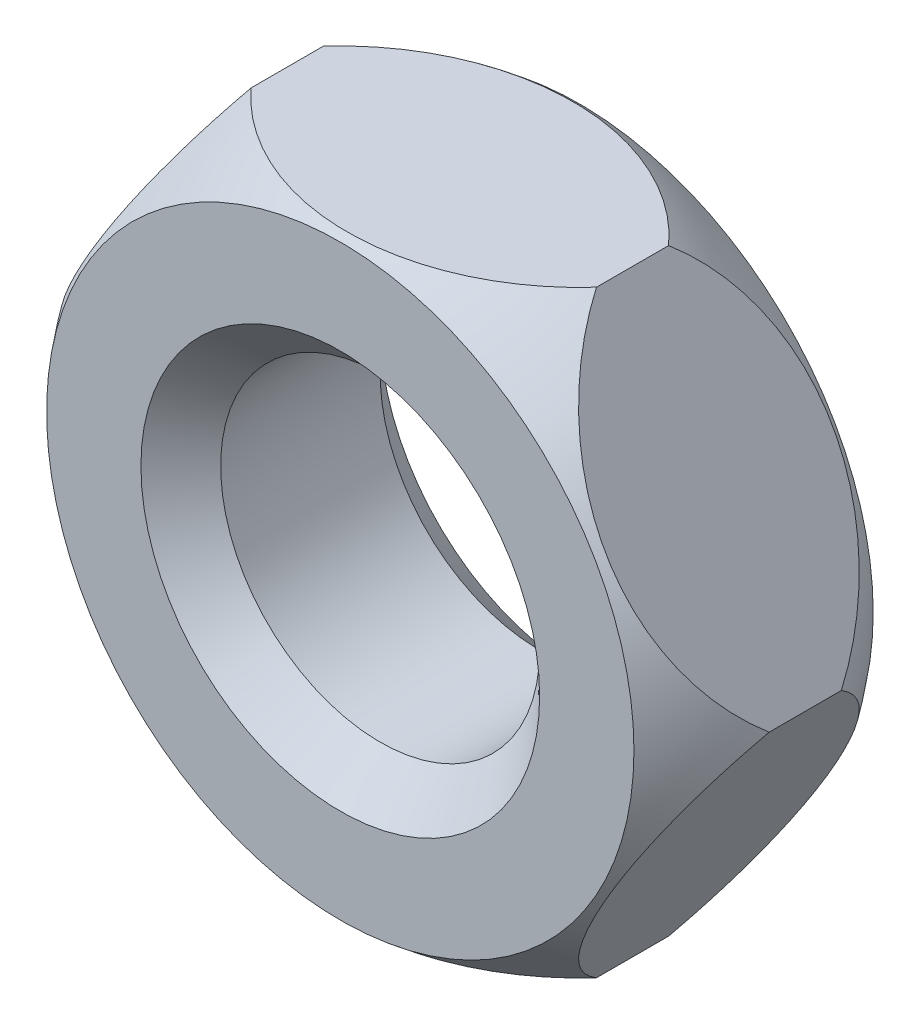
from build123d import *

# Parameters (mm, degrees)
SKETCH1_R           = 2
BOSS_EXTRUDE1_DEPTH = 3
CHAMFER1_SIZE       = 0.5


with BuildPart() as part:
    # Sketch1 → Boss-Extrude1 (new body)
    with BuildSketch(Plane.XY):
        Polygon((4.330127019, 0), (2.165063509, 3.75), (-2.165063509, 3.75), (-4.330127019, 0), (-2.165063509, -3.75), (2.165063509, -3.75), align=None)
        Circle(SKETCH1_R, mode=Mode.SUBTRACT)
    extrude(amount=BOSS_EXTRUDE1_DEPTH)

    # Sketch2 → Cut-Revolve1 (revolve, cut)
    with BuildSketch(Plane(origin=(0, 0, 0), x_dir=(1, 0, 0), z_dir=(0, 1, 0)), mode=Mode.PRIVATE) as cut_revolve1_sk:
        with BuildLine():
            Line((-4.330127019, -1.952562419), (-6.415307532, -1.952562419))
            ThreePointArc((-6.415307532, -1.952562419), (-3.99218262, -5.388056111), (0, -6.70586838))
            Line((0, -6.70586838), (0, -4.75))
            ThreePointArc((0, -4.75), (-2.577579146, -3.989810239), (-4.330127019, -1.952562419))
        make_face()
    cut_revolve1 = revolve(cut_revolve1_sk.sketch.rotate(Axis((0, 0, 1.952562419), (0, 0, 1)), 180), axis=Axis((0, 0, 1.952562419), (0, 0, 1)), mode=Mode.SUBTRACT)

    # Mirror1: Cut-Revolve1 across plane
    add(cut_revolve1.mirror(Plane(origin=(0, 0, 1.5), x_dir=(1, 0, 0), z_dir=(0, 0, -1))), mode=Mode.SUBTRACT)

    # Chamfer1
    chamfer1_edges = [part.edges().sort_by_distance(p)[0] for p in [
        (-2, 0, 0),
        (-2, 0, 3),
    ]]
    chamfer(chamfer1_edges, length=CHAMFER1_SIZE)


solid = part.part
